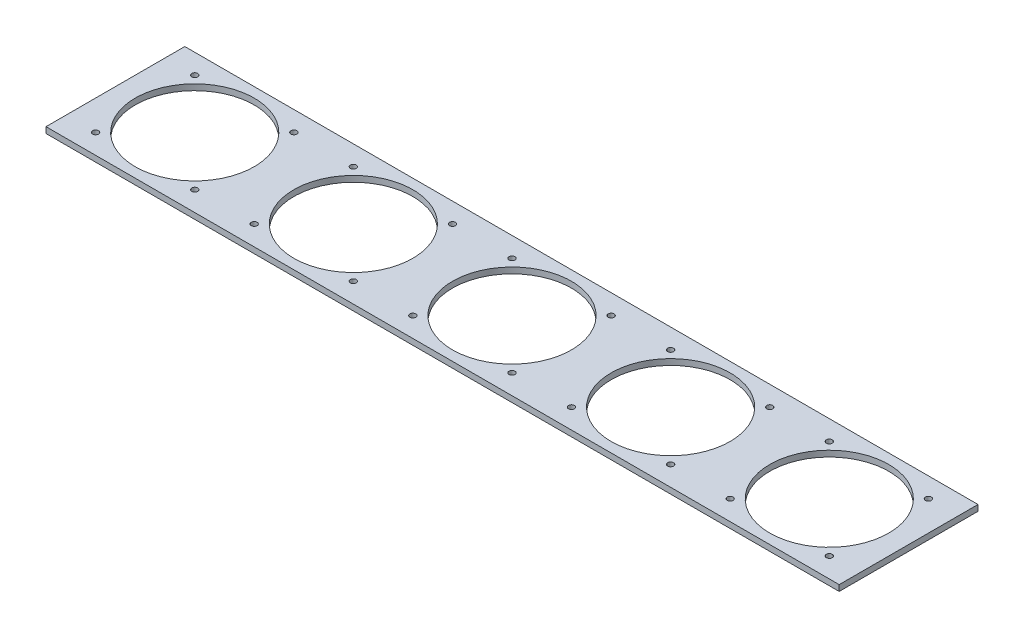
from build123d import *

# Parameters (mm, degrees)
SKETCH1_W           = 400
SKETCH1_H           = 70
SKETCH1_R           = 30
SKETCH1_R_2         = 1.5
BOSS_EXTRUDE1_DEPTH = 3


with BuildPart() as part:
    # Sketch1 → Boss-Extrude1 (new body)
    with BuildSketch(Plane(origin=(0, 0, 0), x_dir=(1, 0, 0), z_dir=(0, 1, 0))):
        with Locations((200, 35)):
            Rectangle(SKETCH1_W, SKETCH1_H)
        with Locations(Location((40, 35, 0), (0, 0, 270))):
            Circle(SKETCH1_R, mode=Mode.SUBTRACT)
        with Locations(Location((120, 35, 0), (0, 0, 270))):
            Circle(SKETCH1_R, mode=Mode.SUBTRACT)
        with Locations(Location((200, 35, 0), (0, 0, 270))):
            Circle(SKETCH1_R, mode=Mode.SUBTRACT)
        with Locations(Location((280, 35, 0), (0, 0, 270))):
            Circle(SKETCH1_R, mode=Mode.SUBTRACT)
        with Locations(Location((360, 35, 0), (0, 0, 270))):
            Circle(SKETCH1_R, mode=Mode.SUBTRACT)
        with Locations(Location((15, 60, 0), (0, 0, 270))):
            Circle(SKETCH1_R_2, mode=Mode.SUBTRACT)
        with Locations(Location((65, 60, 0), (0, 0, 270))):
            Circle(SKETCH1_R_2, mode=Mode.SUBTRACT)
        with Locations(Location((65, 10, 0), (0, 0, 270))):
            Circle(SKETCH1_R_2, mode=Mode.SUBTRACT)
        with Locations(Location((15, 10, 0), (0, 0, 270))):
            Circle(SKETCH1_R_2, mode=Mode.SUBTRACT)
        with Locations(Location((95, 60, 0), (0, 0, 270))):
            Circle(SKETCH1_R_2, mode=Mode.SUBTRACT)
        with Locations(Location((145, 60, 0), (0, 0, 270))):
            Circle(SKETCH1_R_2, mode=Mode.SUBTRACT)
        with Locations(Location((145, 10, 0), (0, 0, 270))):
            Circle(SKETCH1_R_2, mode=Mode.SUBTRACT)
        with Locations(Location((95, 10, 0), (0, 0, 270))):
            Circle(SKETCH1_R_2, mode=Mode.SUBTRACT)
        with Locations(Location((175, 60, 0), (0, 0, 270))):
            Circle(SKETCH1_R_2, mode=Mode.SUBTRACT)
        with Locations(Location((225, 60, 0), (0, 0, 270))):
            Circle(SKETCH1_R_2, mode=Mode.SUBTRACT)
        with Locations(Location((225, 10, 0), (0, 0, 270))):
            Circle(SKETCH1_R_2, mode=Mode.SUBTRACT)
        with Locations(Location((175, 10, 0), (0, 0, 270))):
            Circle(SKETCH1_R_2, mode=Mode.SUBTRACT)
        with Locations(Location((255, 60, 0), (0, 0, 270))):
            Circle(SKETCH1_R_2, mode=Mode.SUBTRACT)
        with Locations(Location((305, 60, 0), (0, 0, 270))):
            Circle(SKETCH1_R_2, mode=Mode.SUBTRACT)
        with Locations(Location((305, 10, 0), (0, 0, 270))):
            Circle(SKETCH1_R_2, mode=Mode.SUBTRACT)
        with Locations(Location((255, 10, 0), (0, 0, 270))):
            Circle(SKETCH1_R_2, mode=Mode.SUBTRACT)
        with Locations(Location((335, 60, 0), (0, 0, 270))):
            Circle(SKETCH1_R_2, mode=Mode.SUBTRACT)
        with Locations(Location((385, 60, 0), (0, 0, 270))):
            Circle(SKETCH1_R_2, mode=Mode.SUBTRACT)
        with Locations(Location((385, 10, 0), (0, 0, 270))):
            Circle(SKETCH1_R_2, mode=Mode.SUBTRACT)
        with Locations(Location((335, 10, 0), (0, 0, 270))):
            Circle(SKETCH1_R_2, mode=Mode.SUBTRACT)
    extrude(amount=BOSS_EXTRUDE1_DEPTH)


solid = part.part
